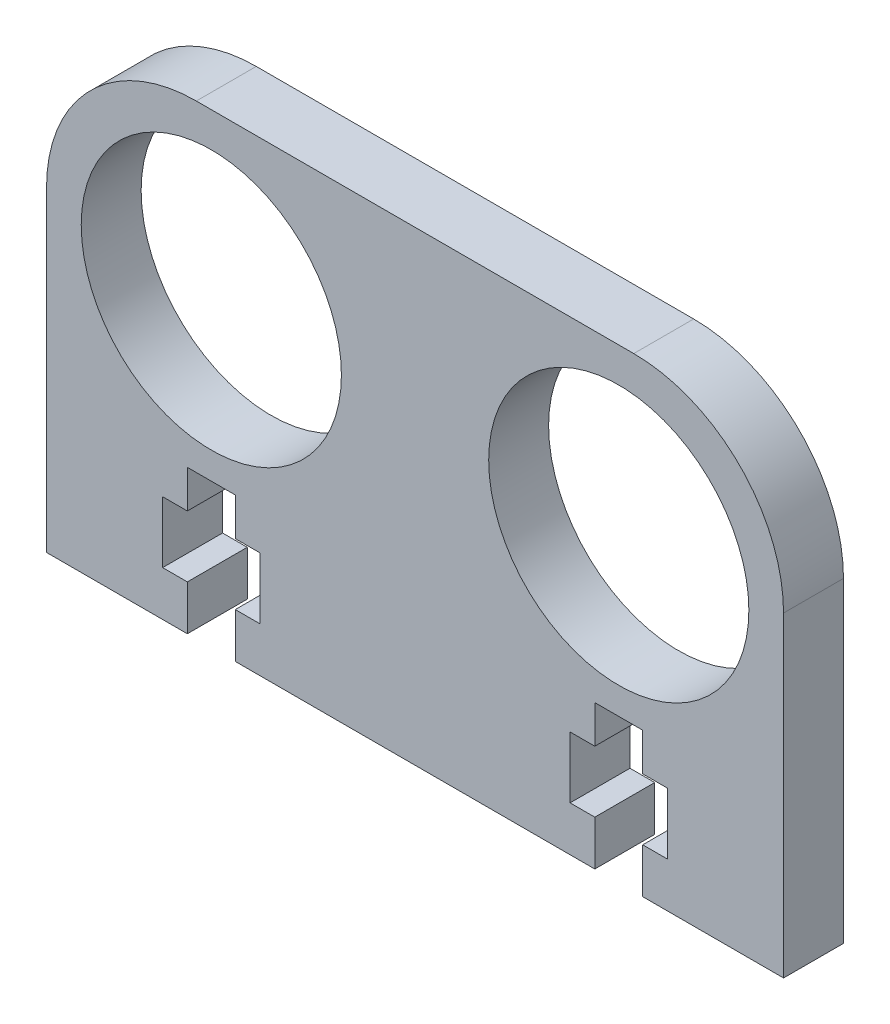
from build123d import *

# Parameters (mm, degrees)
ESBO_O1_R                = 8.05
RESSALTO_EXTRUS_O1_DEPTH = 4
ESCALA1_SCALE            = 0.95
ESBO_O2_R                = 8.25
ESBO_O2_R_2              = 7.6475
CORTE_EXTRUS_O1_DEPTH    = 10


with BuildPart() as part:
    # Esboço1 → Ressalto-extrusão1 (new body)
    with BuildSketch(Plane.XY):
        with BuildLine():
            Line((-9.55, -16.1), (-11.2, -16.1))
            Line((-11.2, -16.1), (-11.2, -18.526258263))
            Line((-11.2, -18.526258263), (-11.2, -19.1))
            Line((-11.2, -19.1), (12.8, -19.1))
            Line((12.8, -19.1), (12.8, -18.526258263))
            Line((12.8, -18.526258263), (12.8, -16.1))
            Line((12.8, -16.1), (11.15, -16.1))
            Line((11.15, -16.1), (11.15, -12))
            Line((11.15, -12), (12.8, -12))
            Line((12.8, -12), (12.8, -9.47671964))
            Line((12.8, -9.47671964), (16, -9.47671964))
            Line((16, -9.47671964), (16, -12))
            Line((16, -12), (17.65, -12))
            Line((17.65, -12), (17.65, -16.1))
            Line((17.65, -16.1), (16, -16.1))
            Line((16, -16.1), (16, -18.526258263))
            Line((16, -18.526258263), (16, -19.1))
            Line((16, -19.1), (25.4, -19.1))
            Line((25.4, -19.1), (25.4, 2))
            ThreePointArc((25.4, 2), (22.471067812, 9.071067812), (15.4, 12))
            Line((15.4, 12), (-13.8, 12))
            ThreePointArc((-13.8, 12), (-20.871067812, 9.071067812), (-23.8, 2))
            Line((-23.8, 2), (-23.8, -19.1))
            Line((-23.8, -19.1), (-14.4, -19.1))
            Line((-14.4, -19.1), (-14.4, -16.1))
            Line((-14.4, -16.1), (-16.05, -16.1))
            Line((-16.05, -16.1), (-16.05, -12))
            Line((-16.05, -12), (-14.4, -12))
            Line((-14.4, -12), (-14.4, -9.47671964))
            Line((-14.4, -9.47671964), (-11.2, -9.47671964))
            Line((-11.2, -9.47671964), (-11.2, -12))
            Line((-11.2, -12), (-9.55, -12))
            Line((-9.55, -12), (-9.55, -16.1))
        make_face()
        with Locations((-12.8, 1)):
            Circle(ESBO_O1_R, mode=Mode.SUBTRACT)
        with Locations((14.4, 1)):
            Circle(ESBO_O1_R, mode=Mode.SUBTRACT)
    extrude(amount=RESSALTO_EXTRUS_O1_DEPTH)


with BuildPart() as part_1:
    # Escala1: scaled about (0.8, -5.041502423, 2)
    add(part.part.scale(ESCALA1_SCALE).moved(Location((0.04, -0.252075121, 0.1))))

    # Esboço2 → Corte-extrusão1 (cut)
    # profile 1 of 2: a face of its own
    with BuildSketch(Plane(origin=(0, 0, 0.1), x_dir=(-1, 0, 0), z_dir=(0, 0, -1))):
        with Locations((12.12, 0.697924879)):
            Circle(ESBO_O2_R)
        with Locations((12.12, 0.697924879)):
            Circle(ESBO_O2_R_2, mode=Mode.SUBTRACT)
    # profile 2 of 2: a face of its own
    with BuildSketch(Plane(origin=(0, 0, 0.1), x_dir=(-1, 0, 0), z_dir=(0, 0, -1))):
        with Locations((-13.72, 0.697924879)):
            Circle(ESBO_O2_R)
        with Locations((-13.72, 0.697924879)):
            Circle(ESBO_O2_R_2, mode=Mode.SUBTRACT)
    extrude(amount=-CORTE_EXTRUS_O1_DEPTH, mode=Mode.SUBTRACT)


solid = part_1.part
